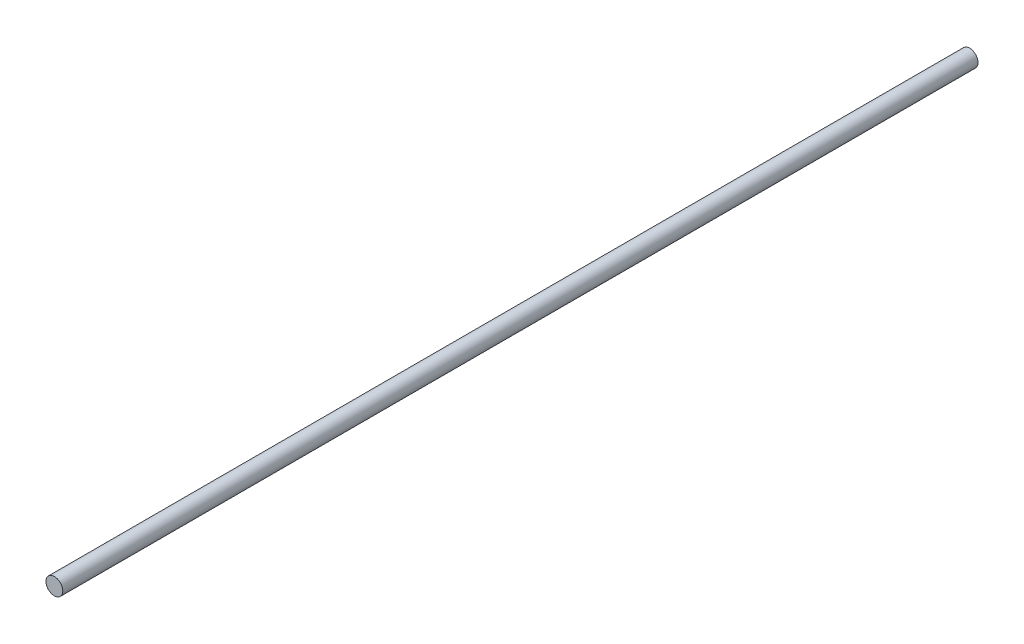
from build123d import *

# Parameters (mm, degrees)
SKETCH1_R           = 4
BOSS_EXTRUDE1_DEPTH = 436


with BuildPart() as part:
    # Sketch1 → Boss-Extrude1 (new body)
    with BuildSketch(Plane.XY):
        Circle(SKETCH1_R)
    extrude(amount=BOSS_EXTRUDE1_DEPTH)


solid = part.part
